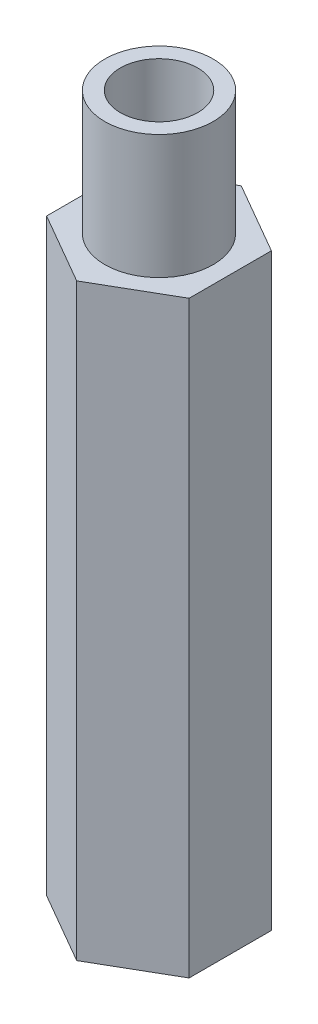
from build123d import *

# Parameters (mm, degrees)
EXTRUDE_1_DEPTH    = 19
SKETCH_2_R         = 1.75
EXTRUDE_2_DEPTH    = 4
HOLE_WIZARD_M3_1_D = 2.5


with BuildPart() as part:
    # 草图1 → 凸台-拉伸1 (new body)
    with BuildSketch(Plane(origin=(0, 0, 0), x_dir=(1, 0, 0), z_dir=(0, 1, 0))):
        Polygon((0, 2.655811238), (-2.3, 1.327905619), (-2.3, -1.327905619), (0, -2.655811238), (2.3, -1.327905619), (2.3, 1.327905619), align=None)
    extrude(amount=EXTRUDE_1_DEPTH)

    # 草图2 → 凸台-拉伸2 (add)
    with BuildSketch(Plane(origin=(0, 19, 0), x_dir=(1, 0, 0), z_dir=(0, 1, 0))):
        with Locations(Location((0, 0, 0), (0, 0, 270))):
            Circle(SKETCH_2_R)
    extrude(amount=EXTRUDE_2_DEPTH)

    # M3 螺纹孔1 (through all)
    with Locations(Plane(origin=(0, 23, 0), x_dir=(1, 0, 0), z_dir=(0, 1, 0))):
        with Locations((0, 0)):
            Hole(HOLE_WIZARD_M3_1_D / 2)


solid = part.part
